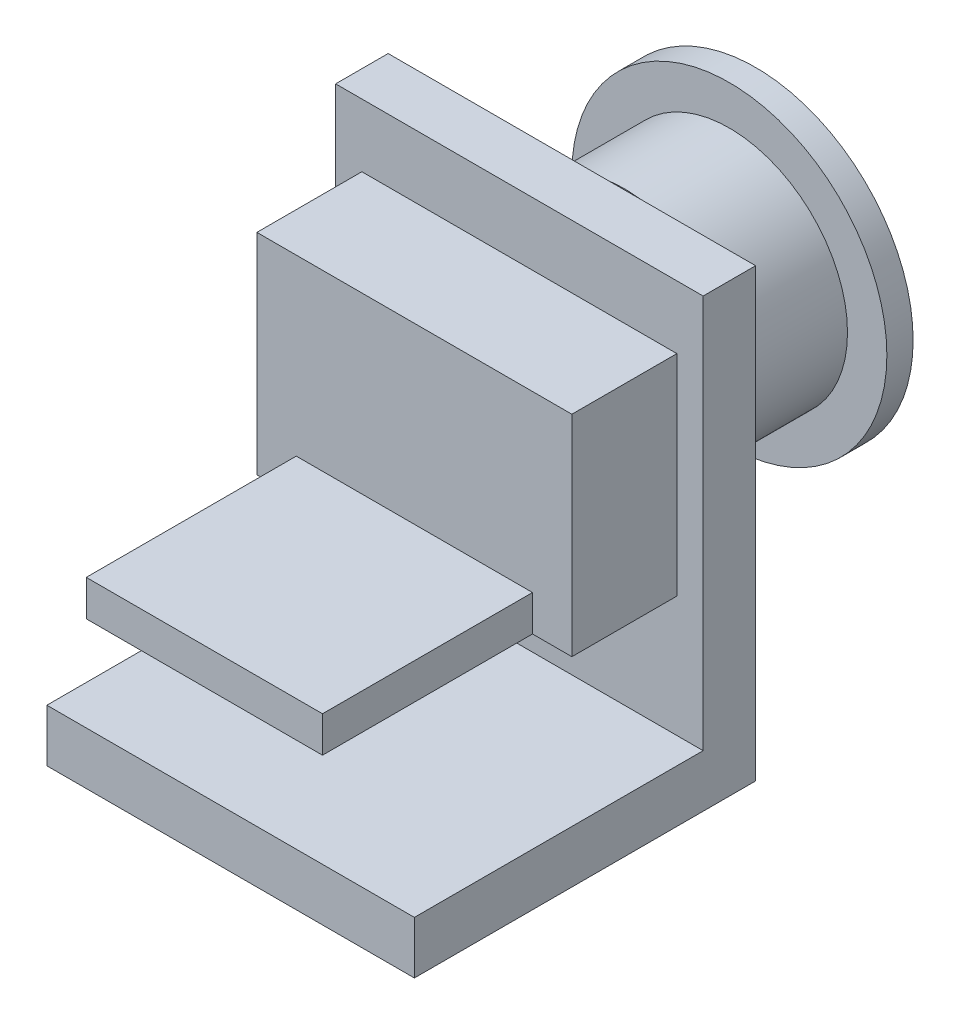
from build123d import *

# Parameters (mm, degrees)
SKETCH1_R           = 19.05
BOSS_EXTRUDE2_DEPTH = 3.175
SKETCH2_R           = 14.2875
BOSS_EXTRUDE3_DEPTH = 12.7
SKETCH5_R           = 12.7
BOSS_EXTRUDE4_DEPTH = 6.35
SKETCH6_W           = 44.45
SKETCH6_H           = 53.975
BOSS_EXTRUDE5_DEPTH = 6.35
SKETCH7_W           = 44.45
SKETCH7_H           = 6.35
BOSS_EXTRUDE6_DEPTH = 34.925
SKETCH8_W           = 38.1
SKETCH8_H           = 25.4
BOSS_EXTRUDE7_DEPTH = 12.7
SKETCH9_W           = 28.575
SKETCH9_H           = 4.343134019
BOSS_EXTRUDE9_DEPTH = 25.4


with BuildPart() as part:
    # Sketch1 → Boss-Extrude2 (new body)
    with BuildSketch(Plane.XY):
        Circle(SKETCH1_R)
    extrude(amount=BOSS_EXTRUDE2_DEPTH)

    # Sketch2 → Boss-Extrude3 (add)
    with BuildSketch(Plane.XY.offset(3.175)):
        Circle(SKETCH2_R)
    extrude(amount=BOSS_EXTRUDE3_DEPTH)

    # Sketch5 → Boss-Extrude4 (add)
    with BuildSketch(Plane.XY.offset(15.875)):
        Circle(SKETCH5_R)
    extrude(amount=BOSS_EXTRUDE4_DEPTH)

    # Sketch6 → Boss-Extrude5 (add)
    with BuildSketch(Plane.XY.offset(22.225)):
        with Locations((0, -6.486273282)):
            Rectangle(SKETCH6_W, SKETCH6_H)
    extrude(amount=BOSS_EXTRUDE5_DEPTH)

    # Sketch7 → Boss-Extrude6 (add)
    with BuildSketch(Plane.XY.offset(28.575)):
        with Locations((0, -30.298773282)):
            Rectangle(SKETCH7_W, SKETCH7_H)
    extrude(amount=BOSS_EXTRUDE6_DEPTH)

    # Sketch8 → Boss-Extrude7 (add)
    with BuildSketch(Plane.XY.offset(28.575)):
        with Locations((0, 0.181226718)):
            Rectangle(SKETCH8_W, SKETCH8_H)
    extrude(amount=BOSS_EXTRUDE7_DEPTH)

    # Sketch9 → Boss-Extrude9 (add)
    with BuildSketch(Plane.XY.offset(41.275)):
        with Locations((0, -10.347206273)):
            Rectangle(SKETCH9_W, SKETCH9_H)
    extrude(amount=BOSS_EXTRUDE9_DEPTH)


solid = part.part
